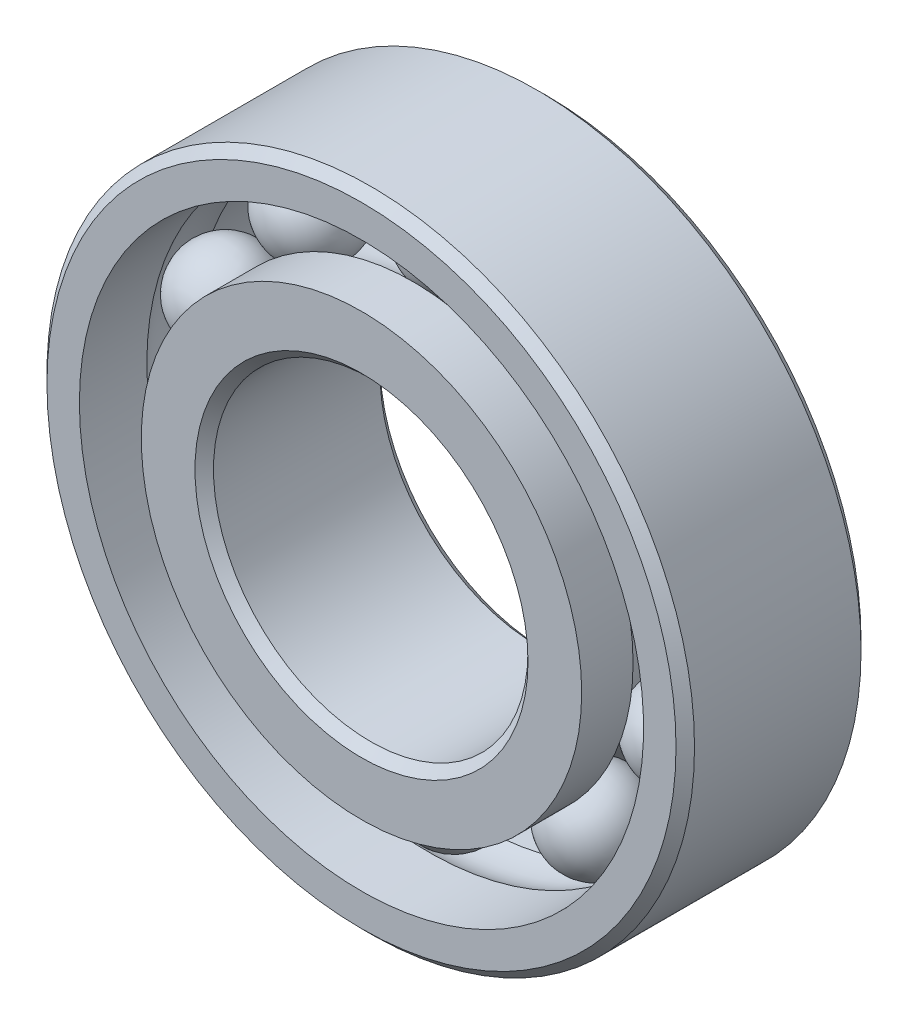
from build123d import *

# Parameters (mm, degrees)
CIRPATTERN1_COUNT = 10


with BuildPart() as part:
    # Sketch1 → Revolve1 (revolve)
    with BuildSketch(Plane(origin=(0, 0, 0), x_dir=(0, 0, -1), z_dir=(1, 0, 0))):
        Polygon((4.5, 17.5), (-4.5, 17.5), (-5, 17), (5, 17), align=None)
    revolve(axis=Axis((0, 0, 5), (0, 0, -1)))


with BuildPart() as body_2:
    # Sketch6 → Revolve9 (revolve)
    with BuildSketch(Plane(origin=(0, 0, 0), x_dir=(0, 0, -1), z_dir=(1, 0, 0))):
        with BuildLine():
            Line((-5, 11.901098901), (-2.222222222, 11.901098901))
            ThreePointArc((-2.222222222, 11.901098901), (0, 10.520916454), (2.222222222, 11.901098901))
            Line((2.222222222, 11.901098901), (5, 11.901098901))
            Line((5, 11.901098901), (5, 9))
            Line((5, 9), (4.5, 8.5))
            Line((4.5, 8.5), (-4.5, 8.5))
            Line((-4.5, 8.5), (-5, 9))
            Line((-5, 9), (-5, 11.901098901))
        make_face()
    revolve(axis=Axis((0, 0, 5), (0, 0, -1)))


with BuildPart() as body_3:
    # Sketch4 → Revolve4 (revolve)
    with BuildSketch(Plane(origin=(0, 0, 0), x_dir=(0, 0, -1), z_dir=(1, 0, 0))):
        with BuildLine():
            Line((-2.479083546, 13), (2.479083546, 13))
            ThreePointArc((2.479083546, 13), (0, 15.479083546), (-2.479083546, 13))
        make_face()
    revolve(axis=Axis((0, 13, 2.479083546), (0, 0, -1)))


with BuildPart() as cirpattern1_1:
    # CirPattern1: pattern copy
    add(body_3.part.rotate(Axis((0, 0, -5), (0, 0, 1)), 1 * 360 / CIRPATTERN1_COUNT))


with BuildPart() as cirpattern1_2:
    # CirPattern1: pattern copy
    add(body_3.part.rotate(Axis((0, 0, -5), (0, 0, 1)), 2 * 360 / CIRPATTERN1_COUNT))


with BuildPart() as cirpattern1_3:
    # CirPattern1: pattern copy
    add(body_3.part.rotate(Axis((0, 0, -5), (0, 0, 1)), 3 * 360 / CIRPATTERN1_COUNT))


with BuildPart() as cirpattern1_4:
    # CirPattern1: pattern copy
    add(body_3.part.rotate(Axis((0, 0, -5), (0, 0, 1)), 4 * 360 / CIRPATTERN1_COUNT))


with BuildPart() as cirpattern1_5:
    # CirPattern1: pattern copy
    add(body_3.part.rotate(Axis((0, 0, -5), (0, 0, 1)), 5 * 360 / CIRPATTERN1_COUNT))


with BuildPart() as cirpattern1_6:
    # CirPattern1: pattern copy
    add(body_3.part.rotate(Axis((0, 0, -5), (0, 0, 1)), 6 * 360 / CIRPATTERN1_COUNT))


with BuildPart() as cirpattern1_7:
    # CirPattern1: pattern copy
    add(body_3.part.rotate(Axis((0, 0, -5), (0, 0, 1)), 7 * 360 / CIRPATTERN1_COUNT))


with BuildPart() as cirpattern1_8:
    # CirPattern1: pattern copy
    add(body_3.part.rotate(Axis((0, 0, -5), (0, 0, 1)), 8 * 360 / CIRPATTERN1_COUNT))


with BuildPart() as cirpattern1_9:
    # CirPattern1: pattern copy
    add(body_3.part.rotate(Axis((0, 0, -5), (0, 0, 1)), 9 * 360 / CIRPATTERN1_COUNT))


with BuildPart() as body_13:
    # Sketch7 → Revolve11 (revolve)
    with BuildSketch(Plane(origin=(0, 0, 0), x_dir=(0, 0, -1), z_dir=(1, 0, 0))):
        with BuildLine():
            Line((1.211636968, 15.246882871), (5, 15.246882871))
            Line((5, 15.246882871), (5, 17))
            Line((5, 17), (-5, 17))
            Line((-5, 17), (-5, 15.246882871))
            Line((-5, 15.246882871), (-1.356206861, 15.246882871))
            ThreePointArc((-1.356206861, 15.246882871), (-0.072284947, 15.60510425), (1.211636968, 15.246882871))
        make_face()
    revolve(axis=Axis((0, 0, -5), (0, 0, 1)))


solid = Compound([part.part, body_2.part, body_3.part, cirpattern1_1.part, cirpattern1_2.part, cirpattern1_3.part, cirpattern1_4.part, cirpattern1_5.part, cirpattern1_6.part, cirpattern1_7.part, cirpattern1_8.part, cirpattern1_9.part, body_13.part])
